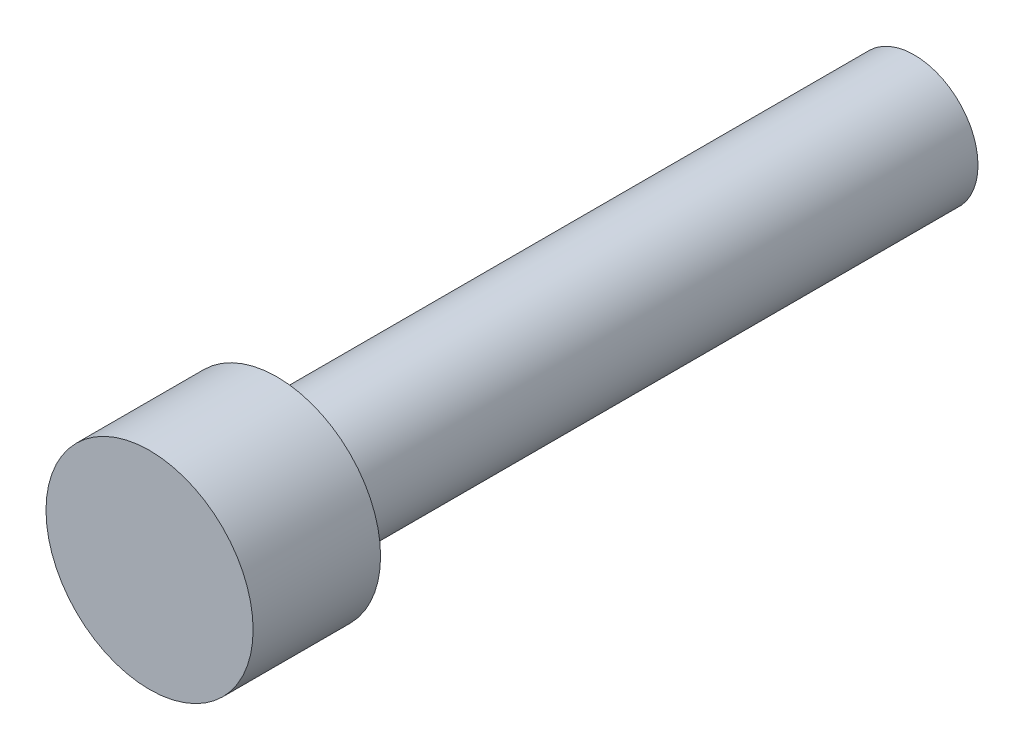
from build123d import *

# Parameters (mm, degrees)
SKETCH1_R           = 6.5
BOSS_EXTRUDE1_DEPTH = 8
SKETCH2_R           = 4
BOSS_EXTRUDE2_DEPTH = 40


with BuildPart() as part:
    # Sketch1 → Boss-Extrude1 (new body)
    with BuildSketch(Plane.XY):
        Circle(SKETCH1_R)
    extrude(amount=BOSS_EXTRUDE1_DEPTH)

    # Sketch2 → Boss-Extrude2 (add)
    with BuildSketch(Plane.XY):
        Circle(SKETCH2_R)
    extrude(amount=-BOSS_EXTRUDE2_DEPTH)


solid = part.part
